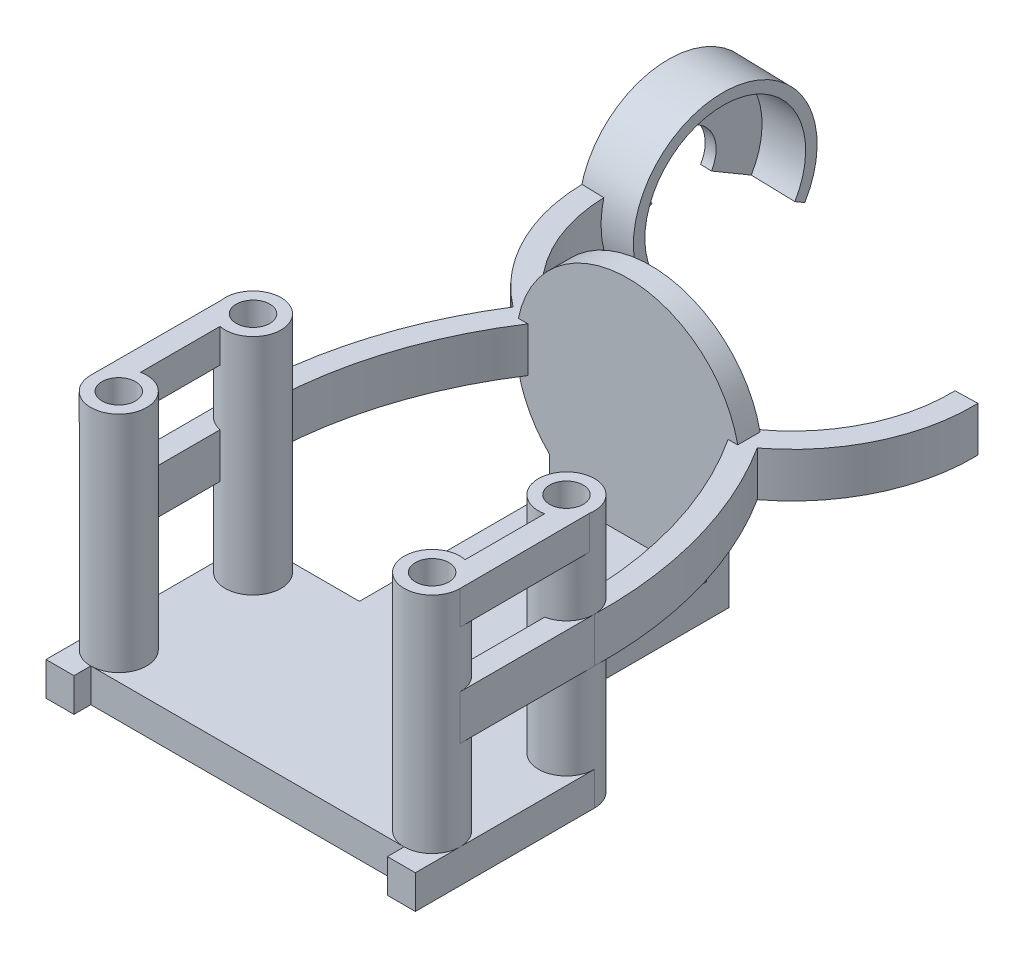
from build123d import *
from build123d.topology import SkipClean

# Parameters (mm, degrees)
SKETCH1_R                = 1.25
SKETCH1_R_2              = 0.75
BOSS_EXTRUDE1_DEPTH      = 10
BOSS_EXTRUDE1_2_DEPTH    = 10
BOSS_EXTRUDE1_3_DEPTH    = 10
BOSS_EXTRUDE1_4_DEPTH    = 10
BOSS_EXTRUDE2_START      = -1.5
BOSS_EXTRUDE2_DEPTH      = 1.5
SKETCH3_W                = 7
SKETCH3_H                = 1.5
BOSS_EXTRUDE3_DEPTH      = 9.5
SKETCH4_R                = 5
BOSS_EXTRUDE4_DEPTH      = 1
BOSS_EXTRUDE5_DEPTH      = 1
BOSS_EXTRUDE5_DEPTH_BACK = 1
BOSS_EXTRUDE7_START      = -1.5
BOSS_EXTRUDE7_DEPTH      = 1.5
CUT_EXTRUDE3_DEPTH       = 10
BOSS_EXTRUDE9_DEPTH      = 0.75
BOSS_EXTRUDE9_DEPTH_BACK = 1.5
SKETCH11_W               = 1.25
SKETCH11_H               = 1.5
REVOLVE1_ANGLE           = 210
REVOLVE1_OTHER_WAY_ANGLE = 30


with BuildPart() as part:
    # Sketch1 → Boss-Extrude1 (new body)
    with BuildSketch(Plane(origin=(0, 0, 0), x_dir=(1, 0, 0), z_dir=(0, 1, 0))):
        with Locations(Location((-7, -3, 0), (0, 0, 270))):
            Circle(SKETCH1_R)
        with Locations(Location((-7, -3, 0), (0, 0, 270))):
            Circle(SKETCH1_R_2, mode=Mode.SUBTRACT)
    extrude(amount=BOSS_EXTRUDE1_DEPTH)



with BuildPart() as body_2:
    # Sketch1 → Boss-Extrude1 2 (new body)
    with BuildSketch(Plane(origin=(0, 0, 0), x_dir=(1, 0, 0), z_dir=(0, 1, 0))):
        with Locations(Location((7, -3, 0), (0, 0, 270))):
            Circle(SKETCH1_R)
        with Locations(Location((7, -3, 0), (0, 0, 270))):
            Circle(SKETCH1_R_2, mode=Mode.SUBTRACT)
    extrude(amount=BOSS_EXTRUDE1_2_DEPTH)


with BuildPart() as body_3:
    # Sketch1 → Boss-Extrude1 3 (new body)
    with BuildSketch(Plane(origin=(0, 0, 0), x_dir=(1, 0, 0), z_dir=(0, 1, 0))):
        with Locations(Location((7, 3, 0), (0, 0, 270))):
            Circle(SKETCH1_R)
        with Locations(Location((7, 3, 0), (0, 0, 270))):
            Circle(SKETCH1_R_2, mode=Mode.SUBTRACT)
    extrude(amount=BOSS_EXTRUDE1_3_DEPTH)


with BuildPart() as body_4:
    # Sketch1 → Boss-Extrude1 4 (new body)
    with BuildSketch(Plane(origin=(0, 0, 0), x_dir=(1, 0, 0), z_dir=(0, 1, 0))):
        with Locations(Location((-7, 3, 0), (0, 0, 270))):
            Circle(SKETCH1_R)
        with Locations(Location((-7, 3, 0), (0, 0, 270))):
            Circle(SKETCH1_R_2, mode=Mode.SUBTRACT)
    extrude(amount=BOSS_EXTRUDE1_4_DEPTH)


with BuildPart() as part_1:
    add(part.part)

    add(body_2.part)  # Boss-Extrude2 merges body 2

    add(body_3.part)  # Boss-Extrude2 merges body 3

    add(body_4.part)  # Boss-Extrude2 merges body 4
    # Sketch1<5> → Boss-Extrude2 (add)
    with BuildSketch(Plane(origin=(0, 0, 0), x_dir=(1, 0, 0), z_dir=(0, 1, 0)).offset(BOSS_EXTRUDE2_START)):
        with BuildLine():
            Line((7, 4.25), (-7, 4.25))
            ThreePointArc((-7, 4.25), (-6.116116524, 3.883883476), (-5.75, 3))
            ThreePointArc((-5.75, 3), (-6.116116524, 2.116116524), (-7, 1.75))
            Line((-7, 1.75), (-7, -1.75))
            ThreePointArc((-7, -1.75), (-6.116116524, -2.116116524), (-5.75, -3))
            ThreePointArc((-5.75, -3), (-6.116116524, -3.883883476), (-7, -4.25))
            Line((-7, -4.25), (7, -4.25))
            ThreePointArc((7, -4.25), (5.75, -3), (7, -1.75))
            Line((7, -1.75), (7, 1.75))
            ThreePointArc((7, 1.75), (5.75, 3), (7, 4.25))
        make_face()
        with BuildLine():
            ThreePointArc((-5.75, 3), (-6.116116524, 3.883883476), (-7, 4.25))
            Line((-7, 4.25), (-7, 3.75))
            ThreePointArc((-7, 3.75), (-6.469669914, 3.530330086), (-6.25, 3))
            ThreePointArc((-6.25, 3), (-6.469669914, 2.469669914), (-7, 2.25))
            Line((-7, 2.25), (-7, 1.75))
            ThreePointArc((-7, 1.75), (-6.116116524, 2.116116524), (-5.75, 3))
        make_face()
        with BuildLine():
            Line((-7, 3.75), (-7, 4.25))
            ThreePointArc((-7, 4.25), (-7.883883476, 3.883883476), (-8.25, 3))
            ThreePointArc((-8.25, 3), (-7.883883476, 2.116116524), (-7, 1.75))
            Line((-7, 1.75), (-7, 2.25))
            ThreePointArc((-7, 2.25), (-7.75, 3), (-7, 3.75))
        make_face()
        with BuildLine():
            ThreePointArc((-7, -1.75), (-7.883883476, -2.116116524), (-8.25, -3))
            ThreePointArc((-8.25, -3), (-7.883883476, -3.883883476), (-7, -4.25))
            Line((-7, -4.25), (-7, -3.75))
            ThreePointArc((-7, -3.75), (-7.75, -3), (-7, -2.25))
            Line((-7, -2.25), (-7, -1.75))
        make_face()
        with BuildLine():
            ThreePointArc((-5.75, -3), (-6.116116524, -2.116116524), (-7, -1.75))
            Line((-7, -1.75), (-7, -2.25))
            ThreePointArc((-7, -2.25), (-6.469669914, -2.469669914), (-6.25, -3))
            ThreePointArc((-6.25, -3), (-6.469669914, -3.530330086), (-7, -3.75))
            Line((-7, -3.75), (-7, -4.25))
            ThreePointArc((-7, -4.25), (-6.116116524, -3.883883476), (-5.75, -3))
        make_face()
        with BuildLine():
            ThreePointArc((7, -4.25), (7.883883476, -3.883883476), (8.25, -3))
            ThreePointArc((8.25, -3), (7.883883476, -2.116116524), (7, -1.75))
            Line((7, -1.75), (7, -2.25))
            ThreePointArc((7, -2.25), (7.530330086, -2.469669914), (7.75, -3))
            ThreePointArc((7.75, -3), (7.530330086, -3.530330086), (7, -3.75))
            Line((7, -3.75), (7, -4.25))
        make_face()
        with BuildLine():
            Line((7, -2.25), (7, -1.75))
            ThreePointArc((7, -1.75), (5.75, -3), (7, -4.25))
            Line((7, -4.25), (7, -3.75))
            ThreePointArc((7, -3.75), (6.25, -3), (7, -2.25))
        make_face()
        with BuildLine():
            ThreePointArc((8.25, 3), (7.883883476, 3.883883476), (7, 4.25))
            Line((7, 4.25), (7, 3.75))
            ThreePointArc((7, 3.75), (7.530330086, 3.530330086), (7.75, 3))
            ThreePointArc((7.75, 3), (7.530330086, 2.469669914), (7, 2.25))
            Line((7, 2.25), (7, 1.75))
            ThreePointArc((7, 1.75), (7.883883476, 2.116116524), (8.25, 3))
        make_face()
        with BuildLine():
            Line((7, 3.75), (7, 4.25))
            ThreePointArc((7, 4.25), (5.75, 3), (7, 1.75))
            Line((7, 1.75), (7, 2.25))
            ThreePointArc((7, 2.25), (6.25, 3), (7, 3.75))
        make_face()
        with BuildLine():
            ThreePointArc((7.75, 3), (7.530330086, 3.530330086), (7, 3.75))
            Line((7, 3.75), (7, 2.25))
            ThreePointArc((7, 2.25), (7.530330086, 2.469669914), (7.75, 3))
        make_face()
        with BuildLine():
            Line((7, 2.25), (7, 3.75))
            ThreePointArc((7, 3.75), (6.25, 3), (7, 2.25))
        make_face()
        with BuildLine():
            ThreePointArc((7.75, -3), (7.530330086, -2.469669914), (7, -2.25))
            Line((7, -2.25), (7, -3.75))
            ThreePointArc((7, -3.75), (7.530330086, -3.530330086), (7.75, -3))
        make_face()
        with BuildLine():
            Line((7, -3.75), (7, -2.25))
            ThreePointArc((7, -2.25), (6.25, -3), (7, -3.75))
        make_face()
        with BuildLine():
            ThreePointArc((-6.25, -3), (-6.469669914, -2.469669914), (-7, -2.25))
            Line((-7, -2.25), (-7, -3.75))
            ThreePointArc((-7, -3.75), (-6.469669914, -3.530330086), (-6.25, -3))
        make_face()
        with BuildLine():
            Line((-7, -3.75), (-7, -2.25))
            ThreePointArc((-7, -2.25), (-7.75, -3), (-7, -3.75))
        make_face()
        with BuildLine():
            ThreePointArc((-6.25, 3), (-6.469669914, 3.530330086), (-7, 3.75))
            Line((-7, 3.75), (-7, 2.25))
            ThreePointArc((-7, 2.25), (-6.469669914, 2.469669914), (-6.25, 3))
        make_face()
        with BuildLine():
            Line((-7, 2.25), (-7, 3.75))
            ThreePointArc((-7, 3.75), (-7.75, 3), (-7, 2.25))
        make_face()
        with BuildLine():
            ThreePointArc((-7, 1.75), (-7.883883476, 2.116116524), (-8.25, 3))
            Line((-8.25, 3), (-8.25, -3))
            ThreePointArc((-8.25, -3), (-7.883883476, -2.116116524), (-7, -1.75))
            Line((-7, -1.75), (-7, 1.75))
        make_face()
        with BuildLine():
            Line((8.25, -3), (8.25, 3))
            ThreePointArc((8.25, 3), (7.883883476, 2.116116524), (7, 1.75))
            Line((7, 1.75), (7, -1.75))
            ThreePointArc((7, -1.75), (7.883883476, -2.116116524), (8.25, -3))
        make_face()
    extrude(amount=BOSS_EXTRUDE2_DEPTH)

    # Sketch3 → Boss-Extrude3 (add)
    with BuildSketch(Plane(origin=(0, 0, -4.25), x_dir=(-1, 0, 0), z_dir=(0, 0, -1))):
        with Locations((0, -0.75)):
            Rectangle(SKETCH3_W, SKETCH3_H)
    extrude(amount=BOSS_EXTRUDE3_DEPTH)

    # Sketch4 → Boss-Extrude4 (add)
    with BuildSketch(Plane(origin=(0, 0, -13.75), x_dir=(-1, 0, 0), z_dir=(0, 0, -1))):
        with Locations((0, 5)):
            Circle(SKETCH4_R)
        with BuildLine():
            ThreePointArc((3.5, 1.429285786), (1.890294809, 0.371092404), (0, 0))
            Line((0, 0), (3.5, 0))
            Line((3.5, 0), (3.5, 1.429285786))
        make_face()
        with BuildLine():
            Line((-3.5, 1.429285786), (-3.5, 0))
            Line((-3.5, 0), (0, 0))
            ThreePointArc((0, 0), (-1.890294809, 0.371092404), (-3.5, 1.429285786))
        make_face()
        Polygon((0, 0), (-3.5, 0), (-3.5, -1.5), (3.5, -1.5), (3.5, 0), align=None)
    extrude(amount=-BOSS_EXTRUDE4_DEPTH)

    # Sketch5 → Boss-Extrude5 (add, two sides: drawn at the far end of the back side and taken through both)
    with BuildSketch(Plane(origin=(0, 5, 0), x_dir=(1, 0, 0), z_dir=(0, 1, 0)).offset(-BOSS_EXTRUDE5_DEPTH_BACK)):
        with BuildLine():
            ThreePointArc((-4.180835575, 13.176441246), (-6.527634607, 8.345563951), (-7.250280019, 3.023663468))
            Line((-7.250280019, 3.023663468), (-8.25, 3))
            ThreePointArc((-8.25, 3), (-7.484846035, 8.634953452), (-5, 13.75))
            Line((-5, 13.75), (-4.180835575, 13.176441246))
        make_face()
        with BuildLine():
            Line((5, 13.75), (4.180835575, 13.176441246))
            ThreePointArc((4.180835575, 13.176441246), (6.527634607, 8.345563951), (7.250280019, 3.023663468))
            Line((7.250280019, 3.023663468), (8.25, 3))
            ThreePointArc((8.25, 3), (7.484846035, 8.634953452), (5, 13.75))
        make_face()
        Polygon((7.250280019, -3), (7.250280019, 3.023663468), (8.25, 3), (8.25, -3), align=None)
        Polygon((-7.250280019, -3), (-8.25, -3), (-8.25, 3), (-7.250280019, 3.023663468), align=None)
        with BuildLine():
            Line((4.551764711, 13.436156691), (5, 13.75))
            ThreePointArc((5, 13.75), (5.230826043, 13.412225154), (5.453915868, 13.069291577))
            ThreePointArc((5.453915868, 13.069291577), (7.861291681, 16.010141752), (8.657577833, 19.72632076))
            Line((8.657577833, 19.72632076), (7.657925348, 19.699959623))
            ThreePointArc((7.657925348, 19.699959623), (6.851009445, 16.226510498), (4.453097378, 13.587196227))
            Line((4.453097378, 13.587196227), (4.551764711, 13.436156691))
        make_face()
        with BuildLine():
            ThreePointArc((5.453915868, 13.069291577), (5.230826043, 13.412225154), (5, 13.75))
            Line((5, 13.75), (4.551764711, 13.436156691))
            Line((4.551764711, 13.436156691), (5, 12.75))
            ThreePointArc((5, 12.75), (5.229700496, 12.905746869), (5.453915868, 13.069291577))
        make_face()
        with BuildLine():
            ThreePointArc((-5.453915868, 13.069291577), (-5.230826043, 13.412225154), (-5, 13.75))
            Line((-5, 13.75), (-4.551764711, 13.436156691))
            Line((-4.551764711, 13.436156691), (-4.453097378, 13.587196227))
            ThreePointArc((-4.453097378, 13.587196227), (-6.851009445, 16.226510498), (-7.657925348, 19.699959623))
            Line((-7.657925348, 19.699959623), (-8.657577833, 19.72632076))
            ThreePointArc((-8.657577833, 19.72632076), (-7.861291681, 16.010141752), (-5.453915868, 13.069291577))
        make_face()
        with BuildLine():
            Line((-4.551764711, 13.436156691), (-5, 13.75))
            ThreePointArc((-5, 13.75), (-5.230826043, 13.412225154), (-5.453915868, 13.069291577))
            ThreePointArc((-5.453915868, 13.069291577), (-5.229700496, 12.905746869), (-5, 12.75))
            Line((-5, 12.75), (-4.551764711, 13.436156691))
        make_face()
    extrude(amount=BOSS_EXTRUDE5_DEPTH + BOSS_EXTRUDE5_DEPTH_BACK)

    # Sketch7 → Boss-Extrude7 (add)
    with BuildSketch(Plane(origin=(0, 10, 0), x_dir=(1, 0, 0), z_dir=(0, 1, 0)).offset(BOSS_EXTRUDE7_START)):
        with BuildLine():
            ThreePointArc((-7.250280019, 1.775312321), (-7.899331852, 2.131839749), (-8.232751249, 2.793059527))
            Line((-8.232751249, 2.793059527), (-8.25, -3))
            Line((-8.25, -3), (-7.250280019, -3))
            Line((-7.250280019, -3), (-7.250280019, 1.775312321))
        make_face()
        Polygon((7.250280019, -3), (7.250280019, 3.023663468), (8.232621703, 2.83656773), (8.25, -3), align=None)
    extrude(amount=BOSS_EXTRUDE7_DEPTH)

    # Sketch1<6> → Cut-Extrude3 (cut)
    with SkipClean():  # the faces are left unmerged after this step: merging them gives an invalid solid
        with BuildSketch(Plane(origin=(0, 0, 0), x_dir=(1, 0, 0), z_dir=(0, 1, 0))):
            with BuildLine():
                ThreePointArc((7.75, 3), (7.530330086, 3.530330086), (7, 3.75))
                Line((7, 3.75), (7, 2.25))
                ThreePointArc((7, 2.25), (7.530330086, 2.469669914), (7.75, 3))
            make_face()
            with BuildLine():
                Line((7, 2.25), (7, 3.75))
                ThreePointArc((7, 3.75), (6.25, 3), (7, 2.25))
            make_face()
            with BuildLine():
                ThreePointArc((7.75, -3), (7.530330086, -2.469669914), (7, -2.25))
                Line((7, -2.25), (7, -3.75))
                ThreePointArc((7, -3.75), (7.530330086, -3.530330086), (7.75, -3))
            make_face()
            with BuildLine():
                Line((7, -3.75), (7, -2.25))
                ThreePointArc((7, -2.25), (6.25, -3), (7, -3.75))
            make_face()
            with BuildLine():
                ThreePointArc((-6.25, -3), (-6.469669914, -2.469669914), (-7, -2.25))
                Line((-7, -2.25), (-7, -3.75))
                ThreePointArc((-7, -3.75), (-6.469669914, -3.530330086), (-6.25, -3))
            make_face()
            with BuildLine():
                Line((-7, -3.75), (-7, -2.25))
                ThreePointArc((-7, -2.25), (-7.75, -3), (-7, -3.75))
            make_face()
            with BuildLine():
                ThreePointArc((-6.25, 3), (-6.469669914, 3.530330086), (-7, 3.75))
                Line((-7, 3.75), (-7, 2.25))
                ThreePointArc((-7, 2.25), (-6.469669914, 2.469669914), (-6.25, 3))
            make_face()
            with BuildLine():
                Line((-7, 2.25), (-7, 3.75))
                ThreePointArc((-7, 3.75), (-7.75, 3), (-7, 2.25))
            make_face()
        extrude(amount=CUT_EXTRUDE3_DEPTH, mode=Mode.SUBTRACT)

    # Sketch11 → Boss-Extrude9 (add, two sides: drawn at the far end of the back side and taken through both)
    with SkipClean():  # the faces are left unmerged after this step: merging them gives an invalid solid
        with BuildSketch(Plane.XY.offset(4.25).offset(-BOSS_EXTRUDE9_DEPTH_BACK)):
            with Locations((-7.625, -0.75)):
                Rectangle(SKETCH11_W, SKETCH11_H)
            with Locations((7.625, -0.75)):
                Rectangle(SKETCH11_W, SKETCH11_H)
        extrude(amount=BOSS_EXTRUDE9_DEPTH + BOSS_EXTRUDE9_DEPTH_BACK)

    # Sketch13 → Revolve1 (revolve)
    with SkipClean():  # the faces are left unmerged after this step: merging them gives an invalid solid
        with BuildSketch(Plane(origin=(0, 5, 0), x_dir=(0.9996524848578904, 0, 0.0263611364976039), z_dir=(0, 1, 0))):
            Polygon((-8.674577428, 21.491241973), (-9.174577425, 21.491241973), (-9.174577425, 18.991241973), (-6.674577425, 18.991241973), (-6.674577425, 19.491241973), (-8.674577427, 19.491241973), align=None)
        revolve(axis=Axis((-8.065487613, 5, -23.211923888), (-0.9996524848578904, 0, -0.026361136497603275)), revolution_arc=REVOLVE1_ANGLE)

    # Sketch13 → Revolve1 other way (revolve)
    with SkipClean():  # the faces are left unmerged after this step: merging them gives an invalid solid
        with BuildSketch(Plane(origin=(0, 5, 0), x_dir=(0.9996524848578904, 0, 0.0263611364976039), z_dir=(0, 1, 0))):
            Polygon((-8.674577428, 21.491241973), (-9.174577425, 21.491241973), (-9.174577425, 18.991241973), (-6.674577425, 18.991241973), (-6.674577425, 19.491241973), (-8.674577427, 19.491241973), align=None)
        revolve(axis=Axis((-8.065487613, 5, -23.211923888), (0.9996524848578904, 0, 0.026361136497603275)), revolution_arc=REVOLVE1_OTHER_WAY_ANGLE)


solid = part_1.part
